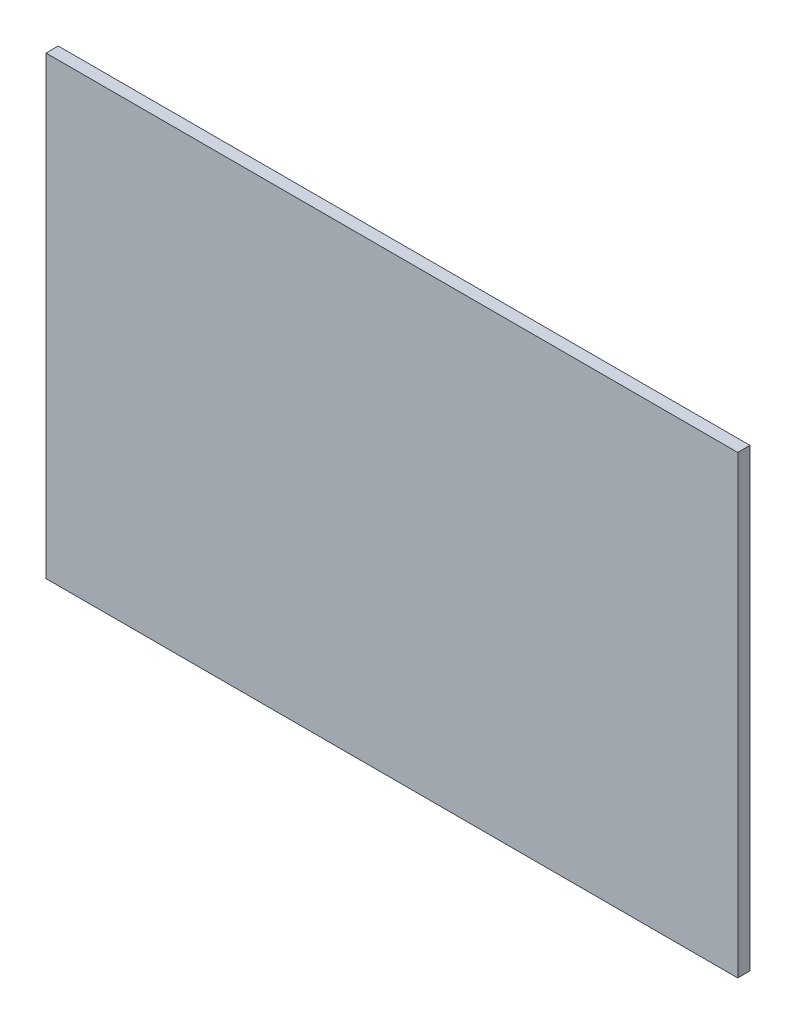
from build123d import *

# Parameters (mm, degrees)
SKETCH1_W           = 170
SKETCH1_H           = 111.868337528
BOSS_EXTRUDE1_DEPTH = 3


with BuildPart() as part:
    # Sketch1 → Boss-Extrude1 (new body)
    with BuildSketch(Plane.XY):
        with Locations((65, -30.044628068)):
            Rectangle(SKETCH1_W, SKETCH1_H)
    extrude(amount=BOSS_EXTRUDE1_DEPTH)


solid = part.part
